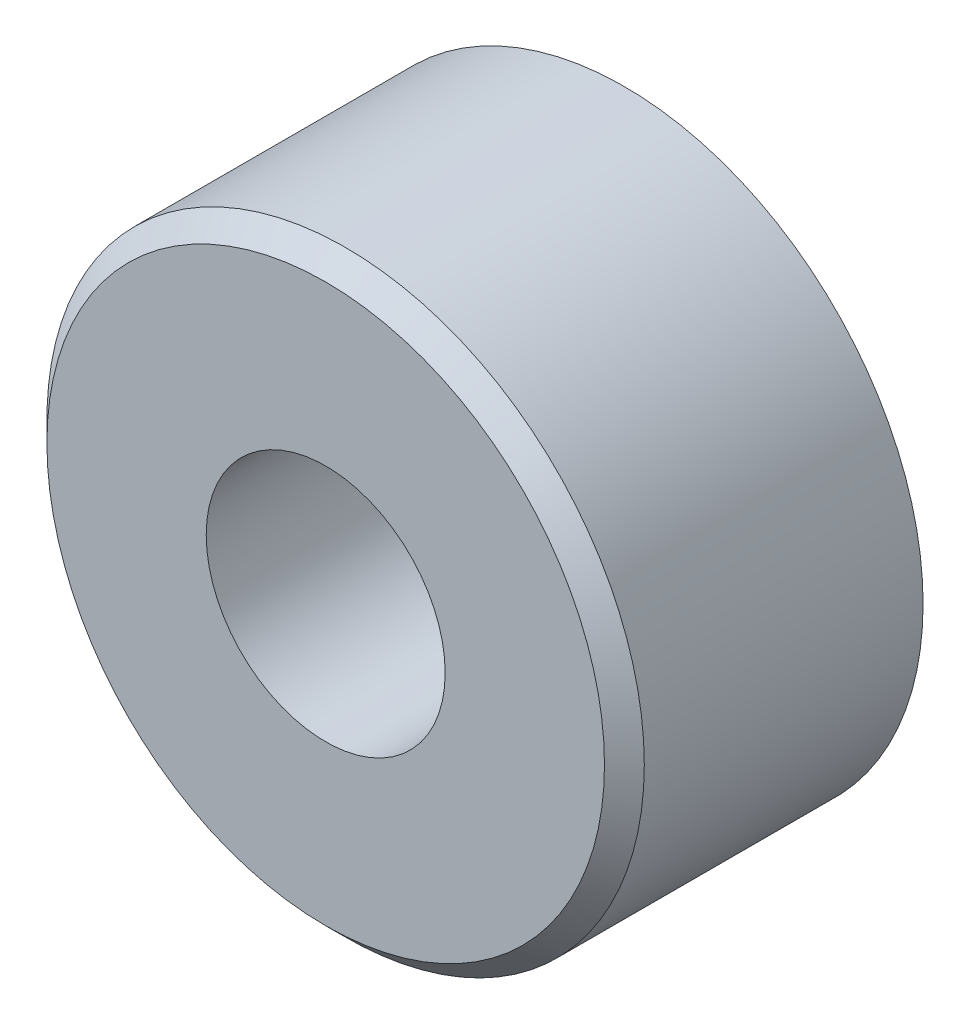
from build123d import *

# Parameters (mm, degrees)
SKETCH1_R           = 7.5
SKETCH1_R_2         = 3
BOSS_EXTRUDE1_DEPTH = 7.5
CHAMFER1_SIZE       = 0.5


with BuildPart() as part:
    # Sketch1 → Boss-Extrude1 (new body)
    with BuildSketch(Plane.XY):
        Circle(SKETCH1_R)
        Circle(SKETCH1_R_2, mode=Mode.SUBTRACT)
    extrude(amount=BOSS_EXTRUDE1_DEPTH)

    # Chamfer1
    chamfer1_edges = [part.edges().sort_by_distance(p)[0] for p in [
        (-7.5, 0, 7.5),
    ]]
    chamfer(chamfer1_edges, length=CHAMFER1_SIZE)


solid = part.part
